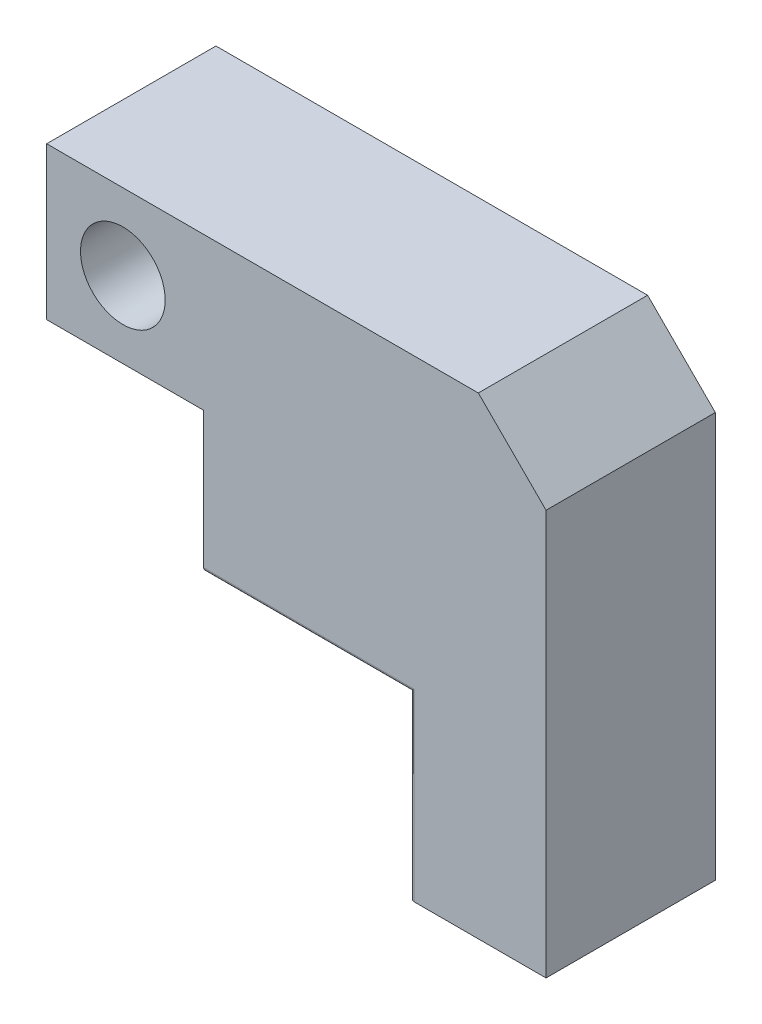
from build123d import *

# Parameters (mm, degrees)
SKETCH_1_R          = 2.5
EXTRUDE_1_DEPTH     = 10
SKETCH_2_R          = 2.5
CUT_EXTRUDE_1_DEPTH = 20
CHAMFER_1_SIZE      = 4
FILLET_1_R          = 0.2


with BuildPart() as part:
    # Эскиз1 → Вытянуть1 (new body)
    with BuildSketch(Plane.XY):
        Polygon((17.000000013, -23.429402734), (17.000000013, -12.754084516), (4.776542266, -12.754084516), (4.776542266, -4.5), (-4.5, -4.5), (-4.5, 4.5), (25.000000013, 4.5), (25.000000013, -23.429402734), align=None)
        Circle(SKETCH_1_R, mode=Mode.SUBTRACT)
    extrude(amount=EXTRUDE_1_DEPTH)

    # Эскиз2 → Вырез-Вытянуть1 (cut)
    with BuildSketch(Plane.XZ.offset(23.429402734)):
        with Locations(Location((21.000000013, 5, 0), (0, 0, 270))):
            Circle(SKETCH_2_R)
    extrude(amount=-CUT_EXTRUDE_1_DEPTH, mode=Mode.SUBTRACT)

    # Фаска1
    chamfer_1_edges = [part.edges().sort_by_distance(p)[0] for p in [
        (25.000000013, 4.5, 5),
    ]]
    chamfer(chamfer_1_edges, length=CHAMFER_1_SIZE)

    # Скругление1
    fillet_1_edges = [part.edges().sort_by_distance(p)[0] for p in [
        (10.88827114, -12.754084516, 10),
        (17.000000013, -18.091743625, 10),
        (17.000000013, -18.091743625, 0),
        (10.88827114, -12.754084516, 0),
    ]]
    fillet(fillet_1_edges, radius=FILLET_1_R)


solid = part.part
